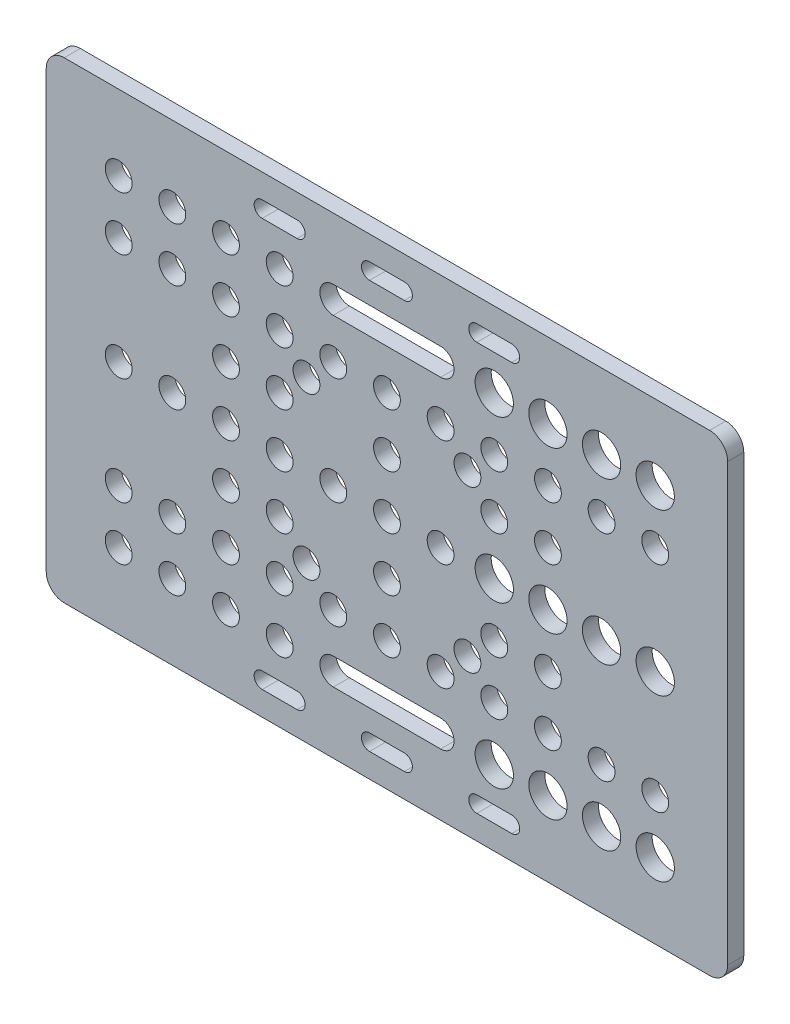
from build123d import *

# Parameters (mm, degrees)
ESQUISSE1_R        = 2.5
ESQUISSE1_R_2      = 3.57
BOSS_EXTRU_1_DEPTH = 1.5


with BuildPart() as part:
    # Esquisse1 → Boss.-Extru.1 (new, symmetric)
    with BuildSketch(Plane.XY):
        with BuildLine():
            Line((-60.14, -44), (60.14, -44))
            ThreePointArc((60.14, -44), (62.515878785, -43.015878785), (63.5, -40.64))
            Line((63.5, -40.64), (63.5, 40.64))
            ThreePointArc((63.5, 40.64), (62.515878785, 43.015878785), (60.14, 44))
            Line((60.14, 44), (-60.14, 44))
            ThreePointArc((-60.14, 44), (-62.515878785, 43.015878785), (-63.5, 40.64))
            Line((-63.5, 40.64), (-63.5, -40.64))
            ThreePointArc((-63.5, -40.64), (-62.515878785, -43.015878785), (-60.14, -44))
        make_face()
        with Locations((0, -20)):
            Circle(ESQUISSE1_R, mode=Mode.SUBTRACT)
        with Locations((10, -20)):
            Circle(ESQUISSE1_R, mode=Mode.SUBTRACT)
        with Locations((20, -20)):
            Circle(ESQUISSE1_R, mode=Mode.SUBTRACT)
        with Locations((30, -20)):
            Circle(ESQUISSE1_R, mode=Mode.SUBTRACT)
        with Locations((40, -20)):
            Circle(ESQUISSE1_R, mode=Mode.SUBTRACT)
        with Locations((50, -20)):
            Circle(ESQUISSE1_R, mode=Mode.SUBTRACT)
        with Locations((-10, -20)):
            Circle(ESQUISSE1_R, mode=Mode.SUBTRACT)
        with Locations((-20, -20)):
            Circle(ESQUISSE1_R, mode=Mode.SUBTRACT)
        with Locations((-30, -20)):
            Circle(ESQUISSE1_R, mode=Mode.SUBTRACT)
        with Locations((-40, -20)):
            Circle(ESQUISSE1_R, mode=Mode.SUBTRACT)
        with Locations((-50, -20)):
            Circle(ESQUISSE1_R, mode=Mode.SUBTRACT)
        with Locations((-50, -30)):
            Circle(ESQUISSE1_R, mode=Mode.SUBTRACT)
        with Locations((-40, -30)):
            Circle(ESQUISSE1_R, mode=Mode.SUBTRACT)
        with Locations((-30, -30)):
            Circle(ESQUISSE1_R, mode=Mode.SUBTRACT)
        with Locations((-20, -30)):
            Circle(ESQUISSE1_R, mode=Mode.SUBTRACT)
        with Locations((50, -30)):
            Circle(ESQUISSE1_R_2, mode=Mode.SUBTRACT)
        with Locations((40, -30)):
            Circle(ESQUISSE1_R_2, mode=Mode.SUBTRACT)
        with Locations((30, -30)):
            Circle(ESQUISSE1_R_2, mode=Mode.SUBTRACT)
        with Locations((20, -30)):
            Circle(ESQUISSE1_R_2, mode=Mode.SUBTRACT)
        with Locations((-50, 0)):
            Circle(ESQUISSE1_R, mode=Mode.SUBTRACT)
        with Locations((-40, 0)):
            Circle(ESQUISSE1_R, mode=Mode.SUBTRACT)
        with Locations((-30, 0)):
            Circle(ESQUISSE1_R, mode=Mode.SUBTRACT)
        with Locations((-20, 0)):
            Circle(ESQUISSE1_R, mode=Mode.SUBTRACT)
        with Locations((-10, 0)):
            Circle(ESQUISSE1_R, mode=Mode.SUBTRACT)
        Circle(ESQUISSE1_R, mode=Mode.SUBTRACT)
        with Locations((10, 0)):
            Circle(ESQUISSE1_R, mode=Mode.SUBTRACT)
        with Locations((20, 0)):
            Circle(ESQUISSE1_R_2, mode=Mode.SUBTRACT)
        with Locations((30, 0)):
            Circle(ESQUISSE1_R_2, mode=Mode.SUBTRACT)
        with Locations((40, 0)):
            Circle(ESQUISSE1_R_2, mode=Mode.SUBTRACT)
        with Locations((50, 0)):
            Circle(ESQUISSE1_R_2, mode=Mode.SUBTRACT)
        with Locations((-30, -10)):
            Circle(ESQUISSE1_R, mode=Mode.SUBTRACT)
        with Locations((-20, -10)):
            Circle(ESQUISSE1_R, mode=Mode.SUBTRACT)
        with Locations(Location((20, -10, 0), (0, 0, 180))):
            Circle(ESQUISSE1_R, mode=Mode.SUBTRACT)
        with Locations(Location((30, -10, 0), (0, 0, 180))):
            Circle(ESQUISSE1_R, mode=Mode.SUBTRACT)
        with Locations((0, -10)):
            Circle(ESQUISSE1_R, mode=Mode.SUBTRACT)
        with Locations((-15, -15)):
            Circle(ESQUISSE1_R, mode=Mode.SUBTRACT)
        with Locations((15, -15)):
            Circle(ESQUISSE1_R, mode=Mode.SUBTRACT)
        with Locations(Location((15, 15, 0), (0, 0, 180))):
            Circle(ESQUISSE1_R, mode=Mode.SUBTRACT)
        with Locations(Location((-15, 15, 0), (0, 0, 180))):
            Circle(ESQUISSE1_R, mode=Mode.SUBTRACT)
        with Locations(Location((0, 10, 0), (0, 0, 180))):
            Circle(ESQUISSE1_R, mode=Mode.SUBTRACT)
        with Locations((30, 10)):
            Circle(ESQUISSE1_R, mode=Mode.SUBTRACT)
        with Locations((20, 10)):
            Circle(ESQUISSE1_R, mode=Mode.SUBTRACT)
        with Locations(Location((-20, 10, 0), (0, 0, 180))):
            Circle(ESQUISSE1_R, mode=Mode.SUBTRACT)
        with Locations(Location((-30, 10, 0), (0, 0, 180))):
            Circle(ESQUISSE1_R, mode=Mode.SUBTRACT)
        with Locations(Location((20, 30, 0), (0, 0, 180))):
            Circle(ESQUISSE1_R_2, mode=Mode.SUBTRACT)
        with Locations(Location((30, 30, 0), (0, 0, 180))):
            Circle(ESQUISSE1_R_2, mode=Mode.SUBTRACT)
        with Locations(Location((40, 30, 0), (0, 0, 180))):
            Circle(ESQUISSE1_R_2, mode=Mode.SUBTRACT)
        with Locations(Location((50, 30, 0), (0, 0, 180))):
            Circle(ESQUISSE1_R_2, mode=Mode.SUBTRACT)
        with Locations(Location((-20, 30, 0), (0, 0, 180))):
            Circle(ESQUISSE1_R, mode=Mode.SUBTRACT)
        with Locations(Location((-30, 30, 0), (0, 0, 180))):
            Circle(ESQUISSE1_R, mode=Mode.SUBTRACT)
        with Locations(Location((-40, 30, 0), (0, 0, 180))):
            Circle(ESQUISSE1_R, mode=Mode.SUBTRACT)
        with Locations(Location((-50, 30, 0), (0, 0, 180))):
            Circle(ESQUISSE1_R, mode=Mode.SUBTRACT)
        with Locations(Location((-50, 20, 0), (0, 0, 180))):
            Circle(ESQUISSE1_R, mode=Mode.SUBTRACT)
        with Locations(Location((-40, 20, 0), (0, 0, 180))):
            Circle(ESQUISSE1_R, mode=Mode.SUBTRACT)
        with Locations(Location((-30, 20, 0), (0, 0, 180))):
            Circle(ESQUISSE1_R, mode=Mode.SUBTRACT)
        with Locations(Location((-20, 20, 0), (0, 0, 180))):
            Circle(ESQUISSE1_R, mode=Mode.SUBTRACT)
        with Locations(Location((-10, 20, 0), (0, 0, 180))):
            Circle(ESQUISSE1_R, mode=Mode.SUBTRACT)
        with Locations(Location((50, 20, 0), (0, 0, 180))):
            Circle(ESQUISSE1_R, mode=Mode.SUBTRACT)
        with Locations(Location((40, 20, 0), (0, 0, 180))):
            Circle(ESQUISSE1_R, mode=Mode.SUBTRACT)
        with Locations(Location((30, 20, 0), (0, 0, 180))):
            Circle(ESQUISSE1_R, mode=Mode.SUBTRACT)
        with Locations(Location((20, 20, 0), (0, 0, 180))):
            Circle(ESQUISSE1_R, mode=Mode.SUBTRACT)
        with Locations(Location((10, 20, 0), (0, 0, 180))):
            Circle(ESQUISSE1_R, mode=Mode.SUBTRACT)
        with Locations(Location((0, 20, 0), (0, 0, 180))):
            Circle(ESQUISSE1_R, mode=Mode.SUBTRACT)
        with BuildLine():
            Line((-10, -27.5), (10, -27.5))
            ThreePointArc((10, -27.5), (12.5, -30), (10, -32.5))
            Line((10, -32.5), (-10, -32.5))
            ThreePointArc((-10, -32.5), (-12.5, -30), (-10, -27.5))
        make_face(mode=Mode.SUBTRACT)
        with BuildLine():
            Line((-23.25, -36.52), (-16.75, -36.52))
            ThreePointArc((-16.75, -36.52), (-15.25, -38.02), (-16.75, -39.52))
            Line((-16.75, -39.52), (-23.25, -39.52))
            ThreePointArc((-23.25, -39.52), (-24.75, -38.02), (-23.25, -36.52))
        make_face(mode=Mode.SUBTRACT)
        with BuildLine():
            Line((-3.25, -36.52), (3.25, -36.52))
            ThreePointArc((3.25, -36.52), (4.75, -38.02), (3.25, -39.52))
            Line((3.25, -39.52), (-3.25, -39.52))
            ThreePointArc((-3.25, -39.52), (-4.75, -38.02), (-3.25, -36.52))
        make_face(mode=Mode.SUBTRACT)
        with BuildLine():
            Line((16.75, -36.52), (23.25, -36.52))
            ThreePointArc((23.25, -36.52), (24.75, -38.02), (23.25, -39.52))
            Line((23.25, -39.52), (16.75, -39.52))
            ThreePointArc((16.75, -39.52), (15.25, -38.02), (16.75, -36.52))
        make_face(mode=Mode.SUBTRACT)
        with BuildLine():
            Line((-10, 27.5), (10, 27.5))
            ThreePointArc((10, 27.5), (12.5, 30), (10, 32.5))
            Line((10, 32.5), (-10, 32.5))
            ThreePointArc((-10, 32.5), (-12.5, 30), (-10, 27.5))
        make_face(mode=Mode.SUBTRACT)
        with BuildLine():
            Line((-23.25, 36.52), (-16.75, 36.52))
            ThreePointArc((-16.75, 36.52), (-15.25, 38.02), (-16.75, 39.52))
            Line((-16.75, 39.52), (-23.25, 39.52))
            ThreePointArc((-23.25, 39.52), (-24.75, 38.02), (-23.25, 36.52))
        make_face(mode=Mode.SUBTRACT)
        with BuildLine():
            Line((-3.25, 36.52), (3.25, 36.52))
            ThreePointArc((3.25, 36.52), (4.75, 38.02), (3.25, 39.52))
            Line((3.25, 39.52), (-3.25, 39.52))
            ThreePointArc((-3.25, 39.52), (-4.75, 38.02), (-3.25, 36.52))
        make_face(mode=Mode.SUBTRACT)
        with BuildLine():
            Line((16.75, 36.52), (23.25, 36.52))
            ThreePointArc((23.25, 36.52), (24.75, 38.02), (23.25, 39.52))
            Line((23.25, 39.52), (16.75, 39.52))
            ThreePointArc((16.75, 39.52), (15.25, 38.02), (16.75, 36.52))
        make_face(mode=Mode.SUBTRACT)
    extrude(amount=BOSS_EXTRU_1_DEPTH, both=True)


solid = part.part
